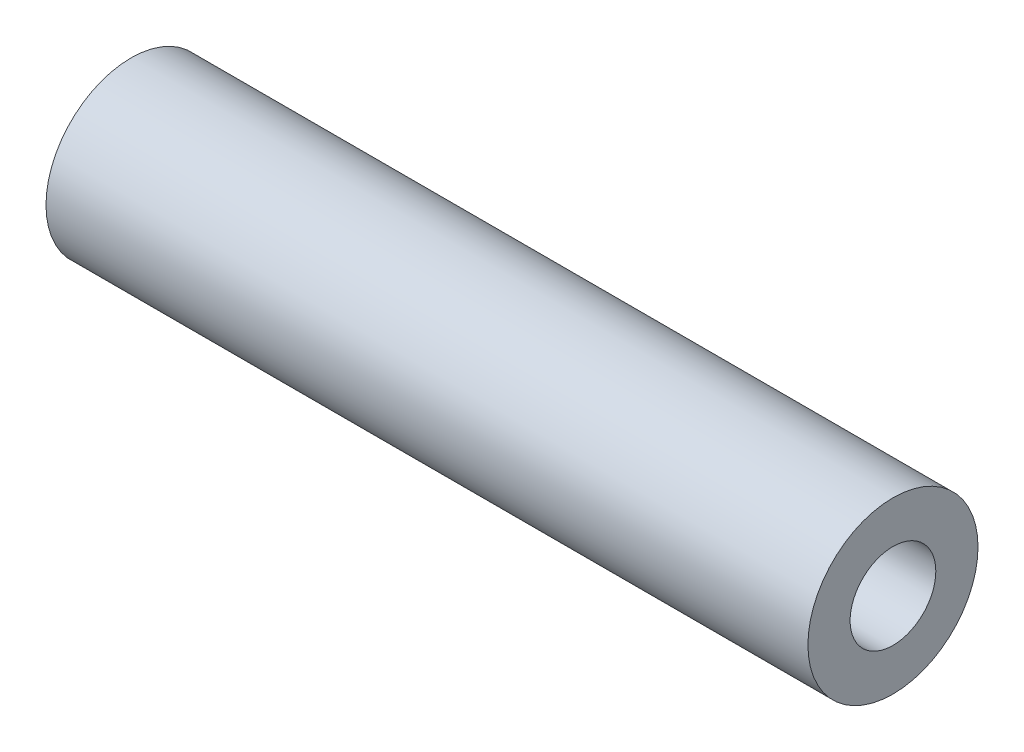
from build123d import *

# Parameters (mm, degrees)
SKETCH1_R           = 3.175
SKETCH1_R_2         = 1.6002
BOSS_EXTRUDE1_DEPTH = 28.448


with BuildPart() as part:
    # Sketch1 → Boss-Extrude1 (new body)
    with BuildSketch(Plane(origin=(0, 0, 0), x_dir=(0, 0, -1), z_dir=(1, 0, 0))):
        Circle(SKETCH1_R)
        Circle(SKETCH1_R_2, mode=Mode.SUBTRACT)
    extrude(amount=BOSS_EXTRUDE1_DEPTH)


solid = part.part
